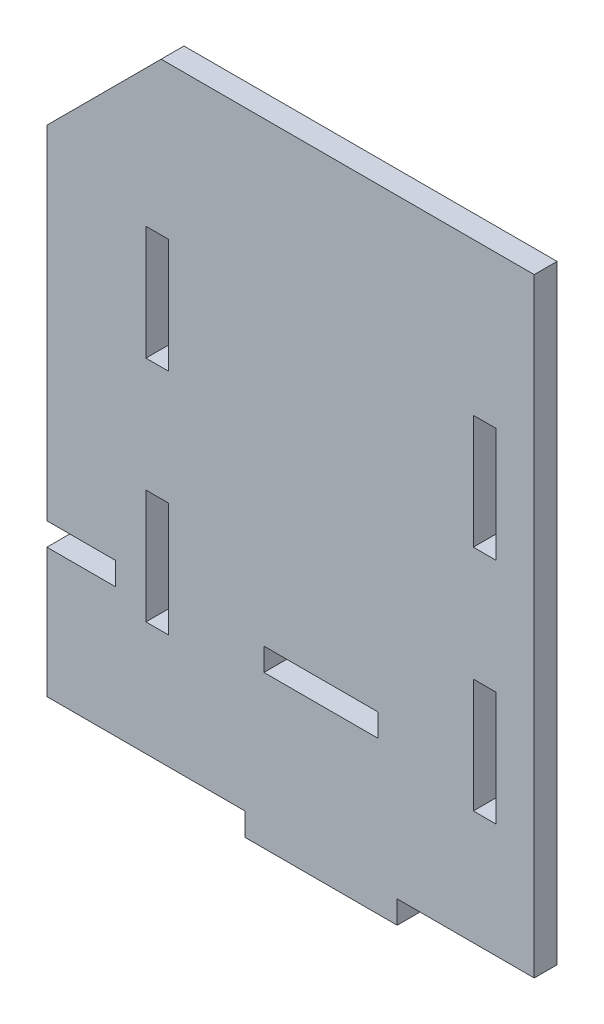
from build123d import *

# Parameters (mm, degrees)
SKETCH_1_W          = 56
SKETCH_1_H          = 80
SKETCH_1_W_2        = 3
SKETCH_1_H_2        = 15
SKETCH_1_W_3        = 20
SKETCH_1_H_3        = 3
EXTRUDE_1_DEPTH     = 3
SKETCH_2_W          = 15
SKETCH_2_H          = 3
CUT_EXTRUDE_1_DEPTH = 3
SKETCH_3_W          = 8
SKETCH_3_H          = 80
EXTRUDE_2_DEPTH     = 3
SKETCH_4_W          = 9
SKETCH_4_H          = 3
CUT_EXTRUDE_2_DEPTH = 3
CHAMFER_1_SIZE      = 15


with BuildPart() as part:
    # 草图1 → 凸台-拉伸1 (new body)
    # profile 1 of 2: a face of its own
    with BuildSketch(Plane.XY):
        Rectangle(SKETCH_1_W, SKETCH_1_H)
        with Locations((21.5, 12.5)):
            Rectangle(SKETCH_1_W_2, SKETCH_1_H_2, mode=Mode.SUBTRACT)
        with Locations((21.5, -17.5)):
            Rectangle(SKETCH_1_W_2, SKETCH_1_H_2, mode=Mode.SUBTRACT)
        with Locations((-21.5, -17.5)):
            Rectangle(SKETCH_1_W_2, SKETCH_1_H_2, mode=Mode.SUBTRACT)
        with Locations((-21.5, 12.5)):
            Rectangle(SKETCH_1_W_2, SKETCH_1_H_2, mode=Mode.SUBTRACT)
    # profile 2 of 2: a face of its own
    with BuildSketch(Plane.XY):
        with Locations((0, -41.5)):
            Rectangle(SKETCH_1_W_3, SKETCH_1_H_3)
    extrude(amount=EXTRUDE_1_DEPTH)

    # 草图2 → 切除-拉伸1 (cut)
    with BuildSketch(Plane.XY.offset(3)):
        with Locations((0, -21.5)):
            Rectangle(SKETCH_2_W, SKETCH_2_H)
    extrude(amount=-CUT_EXTRUDE_1_DEPTH, mode=Mode.SUBTRACT)

    # 草图3 → 凸台-拉伸2 (add)
    with BuildSketch(Plane.XY.offset(3)):
        with Locations((-32, 0)):
            Rectangle(SKETCH_3_W, SKETCH_3_H)
    extrude(amount=-EXTRUDE_2_DEPTH)

    # 草图4 → 切除-拉伸2 (cut)
    with BuildSketch(Plane.XY.offset(3)):
        with Locations((-31.5, -21.5)):
            Rectangle(SKETCH_4_W, SKETCH_4_H)
    extrude(amount=-CUT_EXTRUDE_2_DEPTH, mode=Mode.SUBTRACT)

    # 倒角1
    chamfer_1_edges = [part.edges().sort_by_distance(p)[0] for p in [
        (-36, 40, 1.5),
    ]]
    chamfer(chamfer_1_edges, length=CHAMFER_1_SIZE)


solid = part.part
